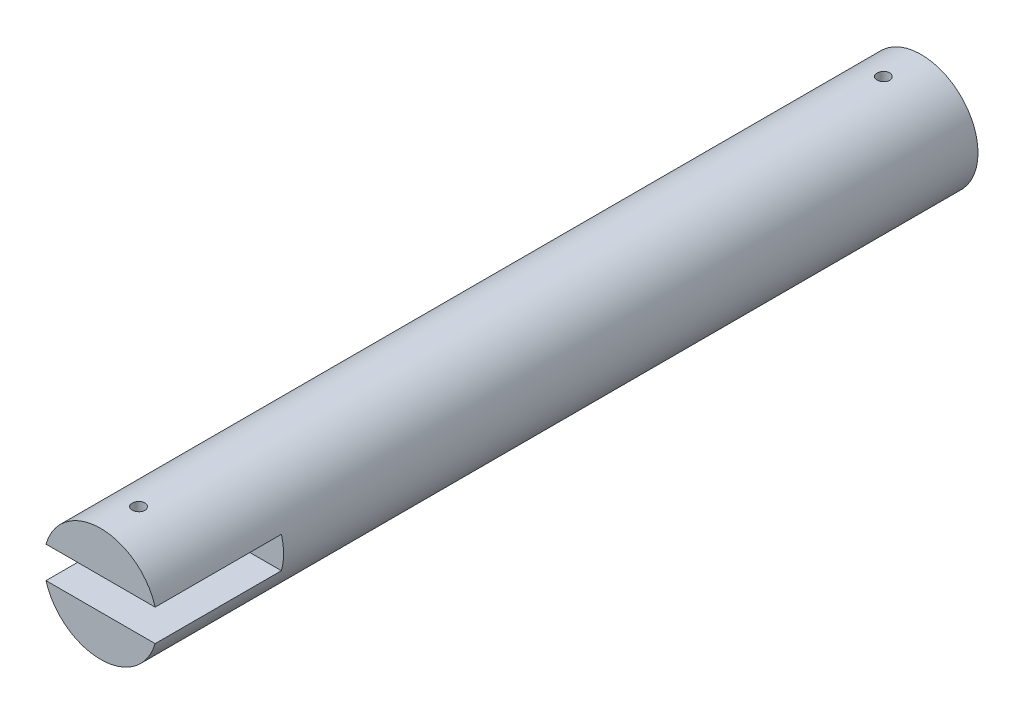
from build123d import *

# Parameters (mm, degrees)
SZKIC1_R                    = 4.5
DODANIE_WYCI_GNI_CIE1_DEPTH = 65
WYTNIJ_WYCI_GNI_CIE1_START  = -10
WYTNIJ_WYCI_GNI_CIE1_DEPTH  = 10
SZKIC3_R                    = 2.5
WYTNIJ_WYCI_GNI_CIE3_DEPTH  = 6
SZKIC4_R                    = 0.5
WYTNIJ_WYCI_GNI_CIE4_DEPTH  = 66.310795432


with BuildPart() as part:
    # Szkic1 → Dodanie-wyciągnięcie1 (new body)
    with BuildSketch(Plane.XY):
        Circle(SZKIC1_R)
    extrude(amount=DODANIE_WYCI_GNI_CIE1_DEPTH)

    # Szkic2 → Wytnij-wyciągnięcie1 (cut)
    with BuildSketch(Plane.XY.offset(65).offset(WYTNIJ_WYCI_GNI_CIE1_START)):
        with BuildLine():
            Line((-4.322904116, 1.25), (4.322904116, 1.25))
            ThreePointArc((4.322904116, 1.25), (4.5, 0), (4.322904116, -1.25))
            Line((4.322904116, -1.25), (-4.322904116, -1.25))
            ThreePointArc((-4.322904116, -1.25), (-4.5, 0), (-4.322904116, 1.25))
        make_face()
    extrude(amount=WYTNIJ_WYCI_GNI_CIE1_DEPTH, mode=Mode.SUBTRACT)

    # Szkic3 → Wytnij-wyciągnięcie3 (cut)
    with BuildSketch(Plane(origin=(0, 0, 0), x_dir=(-1, 0, 0), z_dir=(0, 0, -1))):
        Circle(SZKIC3_R)
    extrude(amount=-WYTNIJ_WYCI_GNI_CIE3_DEPTH, mode=Mode.SUBTRACT)

    # Szkic4 → Wytnij-wyciągnięcie4 (cut, symmetric)
    with BuildSketch(Plane(origin=(0, 0, 0), x_dir=(1, 0, 0), z_dir=(0, 1, 0))):
        with Locations(Location((0, -3, 0), (0, 0, 90))):
            Circle(SZKIC4_R)
    wytnij_wyci_gni_cie4 = extrude(amount=WYTNIJ_WYCI_GNI_CIE4_DEPTH, both=True, mode=Mode.SUBTRACT)

    # Lustro1: Wytnij-wyciągnięcie4 across plane
    add(wytnij_wyci_gni_cie4.mirror(Plane(origin=(0, 0, 32.5), x_dir=(1, 0, 0), z_dir=(0, 0, -1))), mode=Mode.SUBTRACT)


solid = part.part
